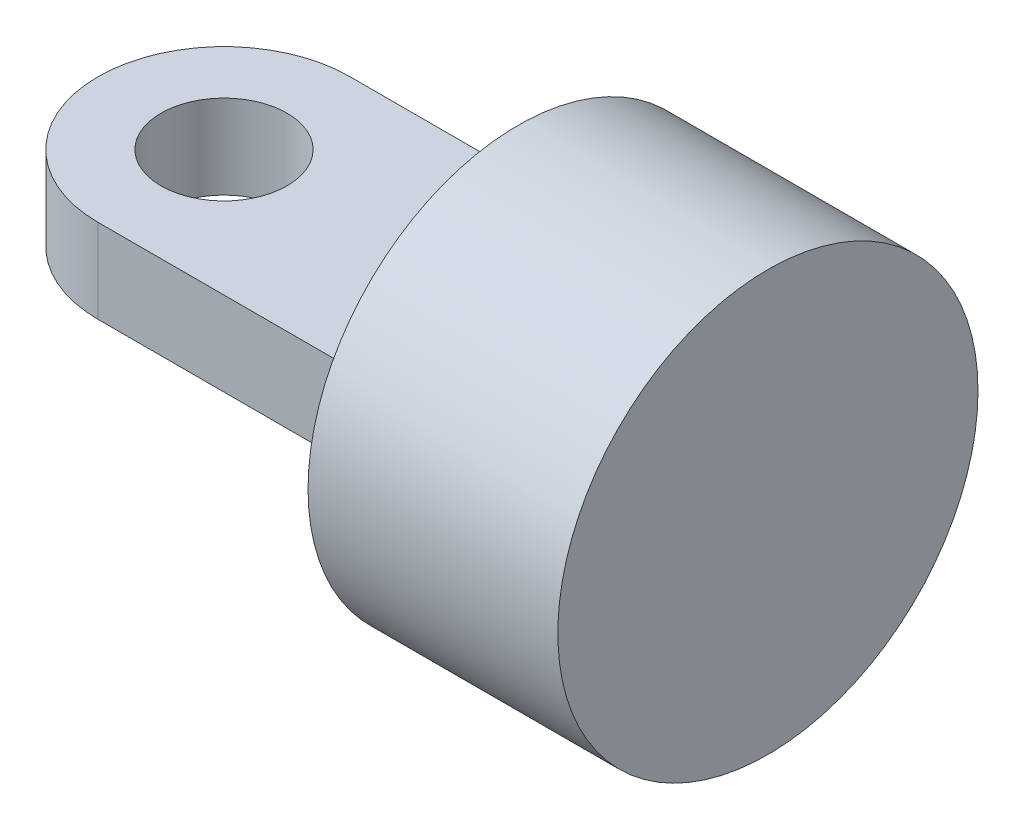
from build123d import *

# Parameters (mm, degrees)
SKETCH1_R                = 50
BOSS_EXTRUDE1_DEPTH      = 129.45
CUT_EXTRUDE1_DEPTH       = 129.45
CUT_EXTRUDE1_DEPTH_BACK  = 129.45
SKETCH3_W                = 73.302623589
SKETCH3_H                = 112.659736925
BOSS_EXTRUDE2_DEPTH      = 10
BOSS_EXTRUDE2_DEPTH_BACK = 10
SKETCH2_R                = 15


with BuildPart() as part:
    # Sketch1 → Boss-Extrude1 (new body)
    with BuildSketch(Plane(origin=(0, 0, 0), x_dir=(0, 0, -1), z_dir=(1, 0, 0))):
        Circle(SKETCH1_R)
    extrude(amount=-BOSS_EXTRUDE1_DEPTH)

    # Sketch3 → Cut-Extrude1 (cut, two sides: drawn at the far end of the back side and taken through both)
    with BuildSketch(Plane(origin=(0, 0, 0), x_dir=(1, 0, 0), z_dir=(0, 1, 0)).offset(-CUT_EXTRUDE1_DEPTH_BACK)):
        with Locations((-96.101311794, -3.115771473)):
            Rectangle(SKETCH3_W, SKETCH3_H)
    extrude(amount=CUT_EXTRUDE1_DEPTH + CUT_EXTRUDE1_DEPTH_BACK, mode=Mode.SUBTRACT)

    # Sketch2 → Boss-Extrude2 (add, two sides: drawn at the far end of the back side and taken through both)
    with BuildSketch(Plane(origin=(0, 0, 0), x_dir=(1, 0, 0), z_dir=(0, 1, 0)).offset(-BOSS_EXTRUDE2_DEPTH_BACK)):
        with BuildLine():
            Line((-129.45, 30), (-59.45, 30))
            Line((-59.45, 30), (-59.45, -30))
            Line((-59.45, -30), (-129.45, -30))
            ThreePointArc((-129.45, -30), (-159.45, 0), (-129.45, 30))
        make_face()
        with Locations((-129.45, 0)):
            Circle(SKETCH2_R, mode=Mode.SUBTRACT)
    extrude(amount=BOSS_EXTRUDE2_DEPTH + BOSS_EXTRUDE2_DEPTH_BACK)


solid = part.part
